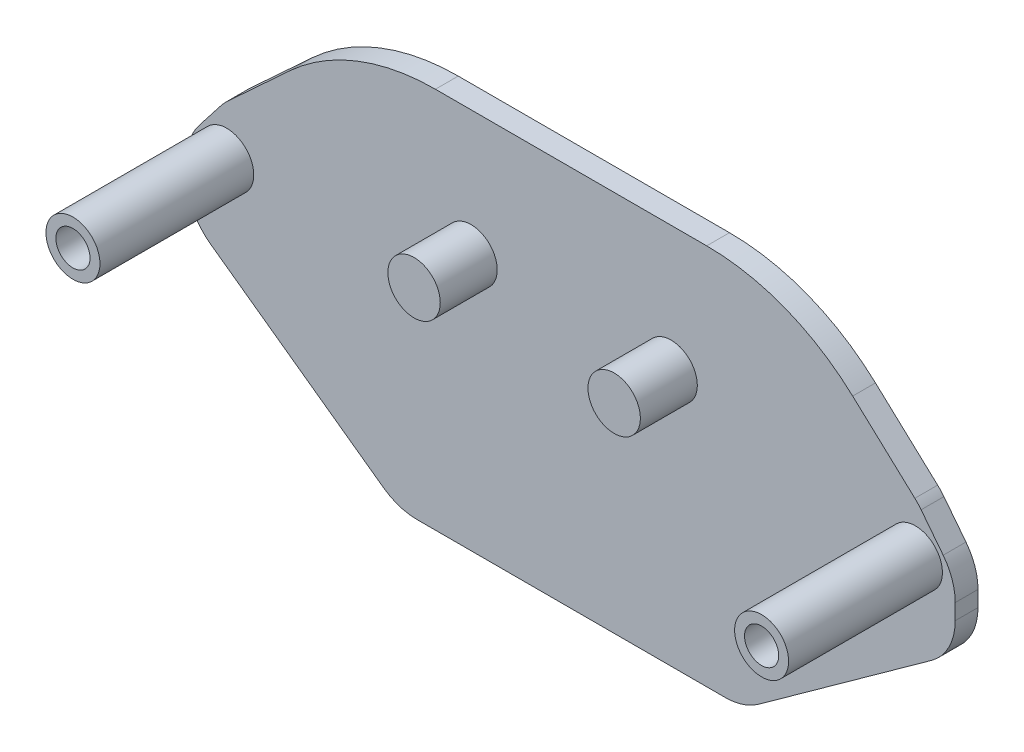
from build123d import *

# Parameters (mm, degrees)
ESQUISSE1_R             = 1.5
BOSS_EXTRU_3_DEPTH      = 2
BOSS_EXTRU_4_START      = -53.32
ESQUISSE2_R             = 2.3
BOSS_EXTRU_4_DEPTH      = 5
ESQUISSE3_R             = 1.5
ENL_V_MAT_EXTRU_1_DEPTH = 10
ESQUISSE4_R             = 2.37
ESQUISSE4_R_2           = 1.5
BOSS_EXTRU_5_DEPTH      = 13.5


with BuildPart() as part:
    # Esquisse1 → Boss.-Extru.3 (new body)
    with BuildSketch(Plane.XY):
        with BuildLine():
            Line((31.640550531, -4.887241018), (16.450544828, -15.819470843))
            ThreePointArc((16.450544828, -15.819470843), (15.064222472, -16.51996197), (13.529826111, -16.761219719))
            Line((13.529826111, -16.761219719), (-13.529826111, -16.761219719))
            ThreePointArc((-13.529826111, -16.761219719), (-15.064222472, -16.51996197), (-16.450544828, -15.819470843))
            Line((-16.450544828, -15.819470843), (-31.640550531, -4.887241018))
            ThreePointArc((-31.640550531, -4.887241018), (-33.169752802, -3.108946738), (-33.719831815, -0.828989895))
            Line((-33.719831815, -0.828989895), (-33.719831815, 0.549989061))
            ThreePointArc((-33.719831815, 0.549989061), (-33.448369589, 2.175083064), (-32.663459607, 3.623716413))
            Line((-32.663459607, 3.623716413), (-30.727499402, 6.107575779))
            ThreePointArc((-30.727499402, 6.107575779), (-30.464326323, 6.418261685), (-30.17674656, 6.706504084))
            Line((-30.17674656, 6.706504084), (-24.719522272, 11.748000297))
            ThreePointArc((-24.719522272, 11.748000297), (-18.785145606, 15.463312907), (-11.905042981, 16.761219719))
            Line((-11.905042981, 16.761219719), (11.905042981, 16.761219719))
            ThreePointArc((11.905042981, 16.761219719), (18.785145606, 15.463312907), (24.719522272, 11.748000297))
            Line((24.719522272, 11.748000297), (30.17674656, 6.706504084))
            ThreePointArc((30.17674656, 6.706504084), (30.464326323, 6.418261685), (30.727499402, 6.107575779))
            Line((30.727499402, 6.107575779), (32.663459607, 3.623716413))
            ThreePointArc((32.663459607, 3.623716413), (33.448369589, 2.175083064), (33.719831815, 0.549989061))
            Line((33.719831815, 0.549989061), (33.719831815, -0.828989895))
            ThreePointArc((33.719831815, -0.828989895), (33.169752802, -3.108946738), (31.640550531, -4.887241018))
        make_face()
        with Locations((-30.225692015, 2.268354752)):
            Circle(ESQUISSE1_R, mode=Mode.SUBTRACT)
        with Locations((30.225692015, 2.268354752)):
            Circle(ESQUISSE1_R, mode=Mode.SUBTRACT)
    extrude(amount=BOSS_EXTRU_3_DEPTH)

    # Esquisse2 → Boss.-Extru.4 (add)
    with BuildSketch(Plane.XY.offset(55.32).offset(BOSS_EXTRU_4_START)):
        with Locations((-8.781978503, 5.736063319)):
            Circle(ESQUISSE2_R)
        with Locations((8.782063878, 5.73606332)):
            Circle(ESQUISSE2_R)
    extrude(amount=BOSS_EXTRU_4_DEPTH)

    # Esquisse3 → Enlèv. mat.-Extru.1 (cut)
    with BuildSketch(Plane(origin=(0, 0, 0), x_dir=(-1, 0, 0), z_dir=(0, 0, -1))):
        with Locations((60.239561974, 19.762236701)):
            Circle(ESQUISSE3_R)
        with Locations((-29.955535999, 19.762236701)):
            Circle(ESQUISSE3_R)
    extrude(amount=-ENL_V_MAT_EXTRU_1_DEPTH, mode=Mode.SUBTRACT)

    # Esquisse4 → Boss.-Extru.5 (add)
    # profile 1 of 2: a face of its own
    with BuildSketch(Plane.XY.offset(2)):
        with Locations((30.225692015, 2.268354752)):
            Circle(ESQUISSE4_R)
        with Locations((30.225692015, 2.268354752)):
            Circle(ESQUISSE4_R_2, mode=Mode.SUBTRACT)
    # profile 2 of 2: a face of its own
    with BuildSketch(Plane.XY.offset(2)):
        with Locations((-30.225692015, 2.268354752)):
            Circle(ESQUISSE4_R)
        with Locations((-30.225692015, 2.268354752)):
            Circle(ESQUISSE4_R_2, mode=Mode.SUBTRACT)
    extrude(amount=BOSS_EXTRU_5_DEPTH)


solid = part.part
